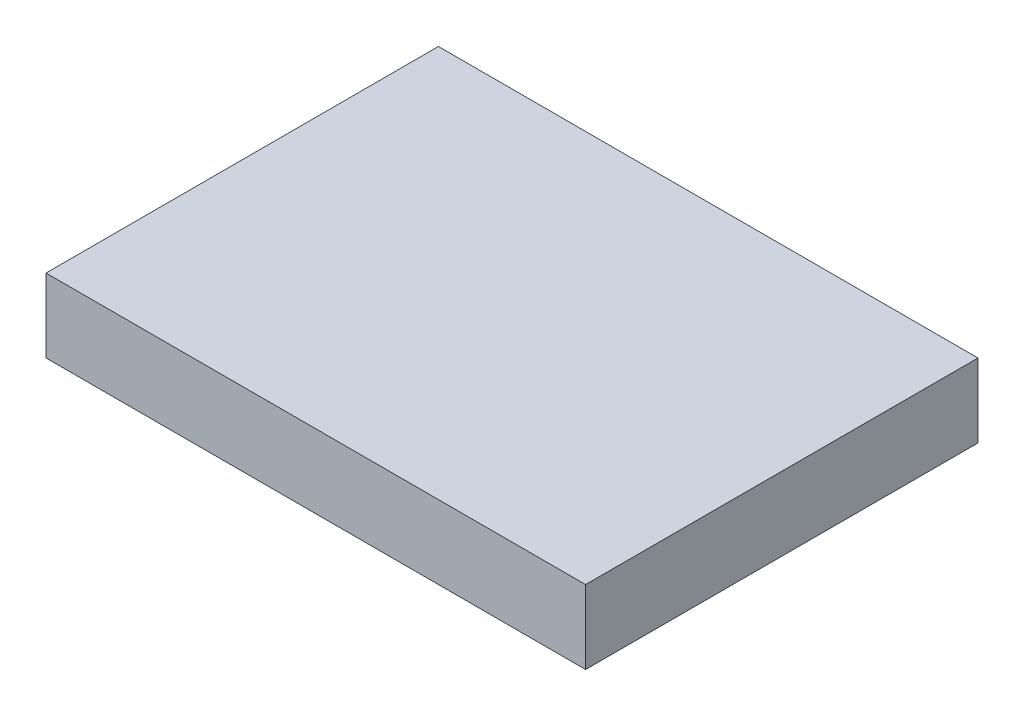
from build123d import *

# Parameters (mm, degrees)
SKETCH1_W           = 69.85
SKETCH1_H           = 50.8
BOSS_EXTRUDE1_DEPTH = 9.525


with BuildPart() as part:
    # Sketch1 → Boss-Extrude1 (new body)
    with BuildSketch(Plane(origin=(0, 0, 0), x_dir=(1, 0, 0), z_dir=(0, 1, 0))):
        with Locations((34.925, 25.4)):
            Rectangle(SKETCH1_W, SKETCH1_H)
    extrude(amount=BOSS_EXTRUDE1_DEPTH)


solid = part.part
